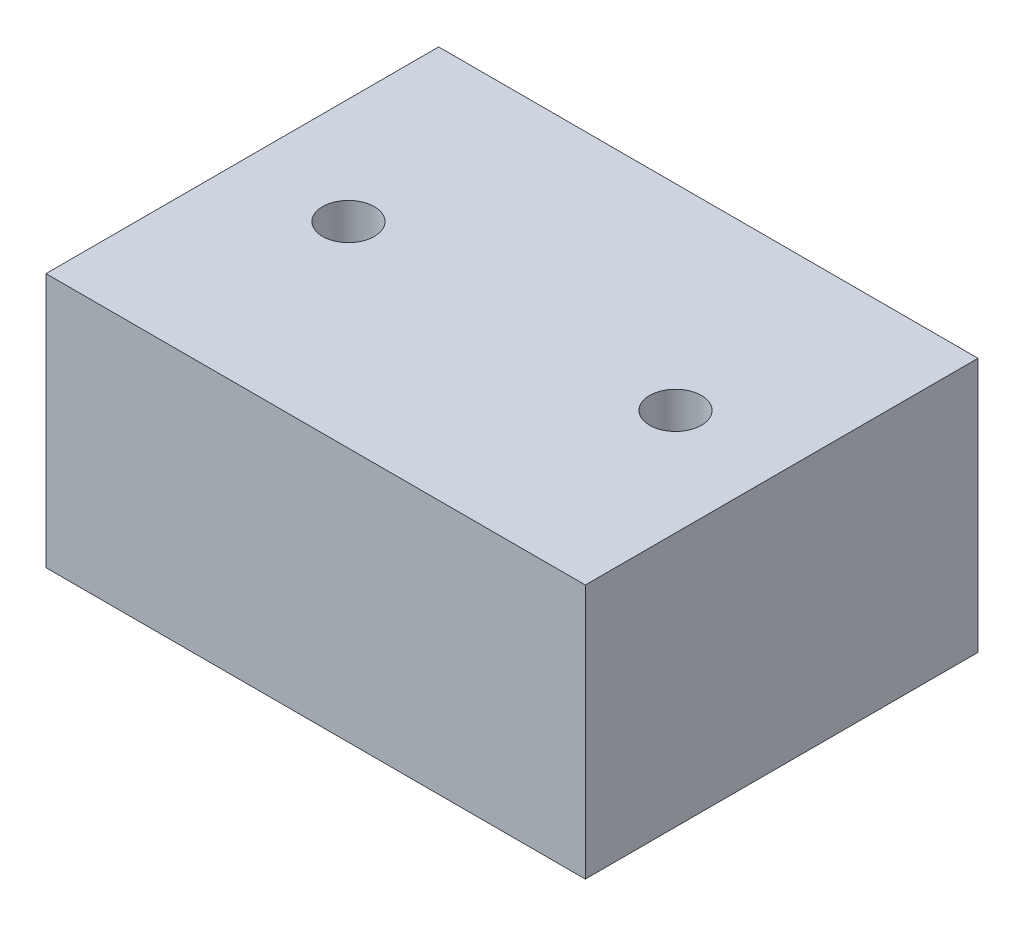
from build123d import *

# Parameters (mm, degrees)
SKETCH1_W                                           = 25.41
SKETCH1_H                                           = 18.5
BOSS_EXTRUDE1_DEPTH                                 = 12
F_2_56_TAPPED_HOLE1_D                               = 1.778
F_2_56_TAPPED_HOLE1_DEPTH                           = 7.46583491
F_2_56_TAPPED_HOLE1_TIP                             = 0.53416509
SKETCH5_R                                           = 3
CUT_EXTRUDE1_DEPTH                                  = 3
CBORE_FOR_2_BINDING_HEAD_MACHINE_SCREW2_D           = 2.4384
CBORE_FOR_2_BINDING_HEAD_MACHINE_SCREW2_CBORE_D     = 5.55752
CBORE_FOR_2_BINDING_HEAD_MACHINE_SCREW2_CBORE_DEPTH = 7.269988


with BuildPart() as part:
    # Sketch1 → Boss-Extrude1 (new body)
    with BuildSketch(Plane(origin=(0, 0, 0), x_dir=(1, 0, 0), z_dir=(0, 1, 0))):
        with Locations((12.705, 9.25)):
            Rectangle(SKETCH1_W, SKETCH1_H)
    extrude(amount=BOSS_EXTRUDE1_DEPTH)

    # #2-56 Tapped Hole1
    with Locations(Plane(origin=(0, 0, 0), x_dir=(-1, 0, 0), z_dir=(0, -1, 0))):
        with Locations((-23.91, 17), (-23.91, 1.5), (-1.5, 1.5), (-1.5, 17)):
            Hole(F_2_56_TAPPED_HOLE1_D / 2, depth=F_2_56_TAPPED_HOLE1_DEPTH)
            with Locations((0, 0, -(F_2_56_TAPPED_HOLE1_DEPTH + F_2_56_TAPPED_HOLE1_TIP / 2))):  # 118° drill point
                Cone(0, F_2_56_TAPPED_HOLE1_D / 2, F_2_56_TAPPED_HOLE1_TIP, mode=Mode.SUBTRACT)

    # Sketch5 → Cut-Extrude1 (cut)
    with BuildSketch(Plane.XZ):
        with Locations(Location((12.705, -9.25, 0), (0, 0, 270))):
            Circle(SKETCH5_R)
    extrude(amount=-CUT_EXTRUDE1_DEPTH, mode=Mode.SUBTRACT)

    # CBORE for #2 Binding Head Machine Screw2 (through all)
    with Locations(Plane(origin=(0, 0, 0), x_dir=(-1, 0, 0), z_dir=(0, -1, 0))):
        with Locations((-20.41, 9.25), (-5, 9.25)):
            CounterBoreHole(CBORE_FOR_2_BINDING_HEAD_MACHINE_SCREW2_D / 2, CBORE_FOR_2_BINDING_HEAD_MACHINE_SCREW2_CBORE_D / 2, CBORE_FOR_2_BINDING_HEAD_MACHINE_SCREW2_CBORE_DEPTH)


solid = part.part
